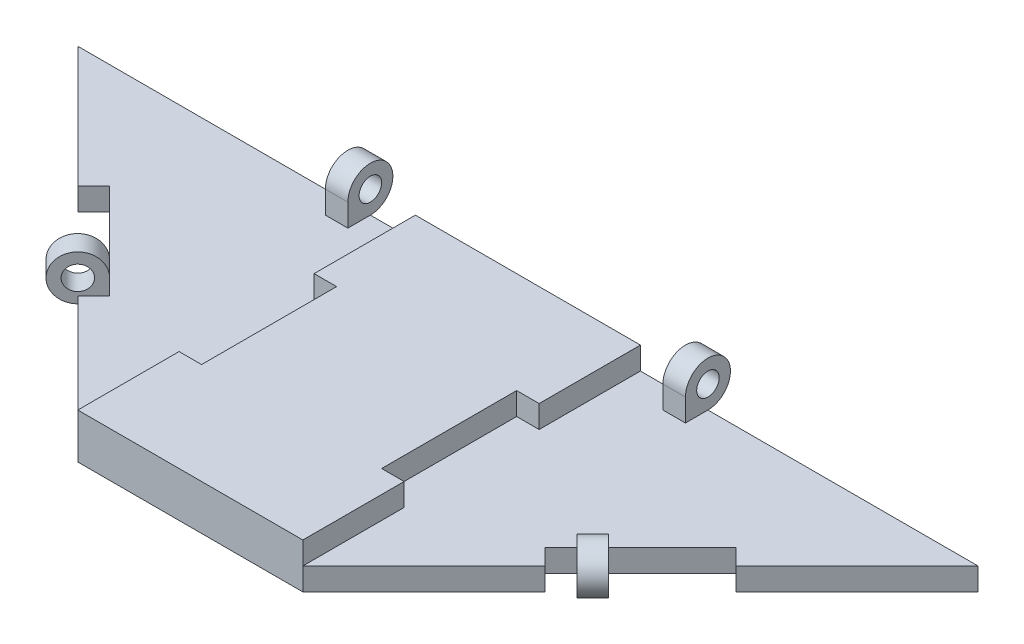
from build123d import *

# Parameters (mm, degrees)
BOSS_EXTRUDE1_DEPTH = 10
CUT_EXTRUDE1_DEPTH  = 5
CUT_EXTRUDE2_REACH  = 143.774
BOSS_EXTRUDE2_START = 5
SKETCH3_R           = 2.634477445
BOSS_EXTRUDE2_DEPTH = 5
BOSS_EXTRUDE3_START = 10
SKETCH4_R           = 2.5
BOSS_EXTRUDE3_DEPTH = 5


with BuildPart() as part:
    # Sketch1 → Boss-Extrude1 (new body)
    with BuildSketch(Plane(origin=(0, 0, 0), x_dir=(1, 0, 0), z_dir=(0, 1, 0))):
        Polygon((-25, 25), (-100, 100), (100, 100), (25, 25), align=None)
    extrude(amount=BOSS_EXTRUDE1_DEPTH)

    # Sketch2 → Cut-Extrude1 (cut)
    with BuildSketch(Plane(origin=(0, 10, 0), x_dir=(1, 0, 0), z_dir=(0, 1, 0))):
        Polygon((-25, 25), (-25, 47.5), (-20, 47.5), (-20, 77.5), (-25, 77.5), (-25, 100), (-100, 100), (-73.106601718, 73.106601718), (-69.571067812, 76.642135624), (-48.357864376, 55.428932188), (-51.893398282, 51.893398282), align=None)
    cut_extrude1 = extrude(amount=-CUT_EXTRUDE1_DEPTH, mode=Mode.SUBTRACT)

    # Sketch2<4> → Cut-Extrude2 (cut, up to next)
    with BuildSketch(Plane(origin=(0, 10, 0), x_dir=(1, 0, 0), z_dir=(0, 1, 0)), mode=Mode.PRIVATE) as cut_extrude2_sk1:
        Polygon((-73.106601718, 73.106601718), (-51.893398282, 51.893398282), (-48.357864376, 55.428932188), (-69.571067812, 76.642135624), align=None)
    cut_extrude2_tool1 = extrude(cut_extrude2_sk1.sketch, amount=-CUT_EXTRUDE2_REACH, mode=Mode.PRIVATE) & part.part
    cut_extrude2 = cut_extrude2_tool1.solids().sort_by_distance((-60.732233, 10, -64.267767))[0]
    add(cut_extrude2, mode=Mode.SUBTRACT)

    # Sketch3 → Boss-Extrude2 (add)
    with BuildSketch(Plane(origin=(-51.893398282, 0, -51.893398282), x_dir=(-0.7071067811865461, 0, 0.7071067811865489), z_dir=(-0.7071067811865489, 0, -0.7071067811865461)).offset(BOSS_EXTRUDE2_START)):
        with BuildLine():
            ThreePointArc((0, 0), (3.535533906, 8.535533906), (-5, 5))
            Line((-5, 5), (-5, 0))
            Line((-5, 0), (0, 0))
        make_face()
        with Locations((0, 5)):
            Circle(SKETCH3_R, mode=Mode.SUBTRACT)
    boss_extrude2 = extrude(amount=BOSS_EXTRUDE2_DEPTH)

    # Sketch4 → Boss-Extrude3 (add)
    with BuildSketch(Plane.ZY.offset(25).offset(BOSS_EXTRUDE3_START)):
        with BuildLine():
            ThreePointArc((-95, 10), (-103.535533906, 13.535533906), (-100, 5))
            Line((-100, 5), (-95, 5))
            Line((-95, 5), (-95, 10))
        make_face()
        with Locations((-100, 10)):
            Circle(SKETCH4_R, mode=Mode.SUBTRACT)
    boss_extrude3 = extrude(amount=BOSS_EXTRUDE3_DEPTH)

    # Mirror1: Cut-Extrude1, Cut-Extrude2, Boss-Extrude2, Boss-Extrude3 across plane
    add(cut_extrude1.mirror(Plane(origin=(0, 0, 0), x_dir=(0, 0, 1), z_dir=(1, 0, 0))), mode=Mode.SUBTRACT)
    add(cut_extrude2.mirror(Plane(origin=(0, 0, 0), x_dir=(0, 0, 1), z_dir=(1, 0, 0))), mode=Mode.SUBTRACT)
    add(boss_extrude2.mirror(Plane(origin=(0, 0, 0), x_dir=(0, 0, 1), z_dir=(1, 0, 0))))
    add(boss_extrude3.mirror(Plane(origin=(0, 0, 0), x_dir=(0, 0, 1), z_dir=(1, 0, 0))))


solid = part.part
